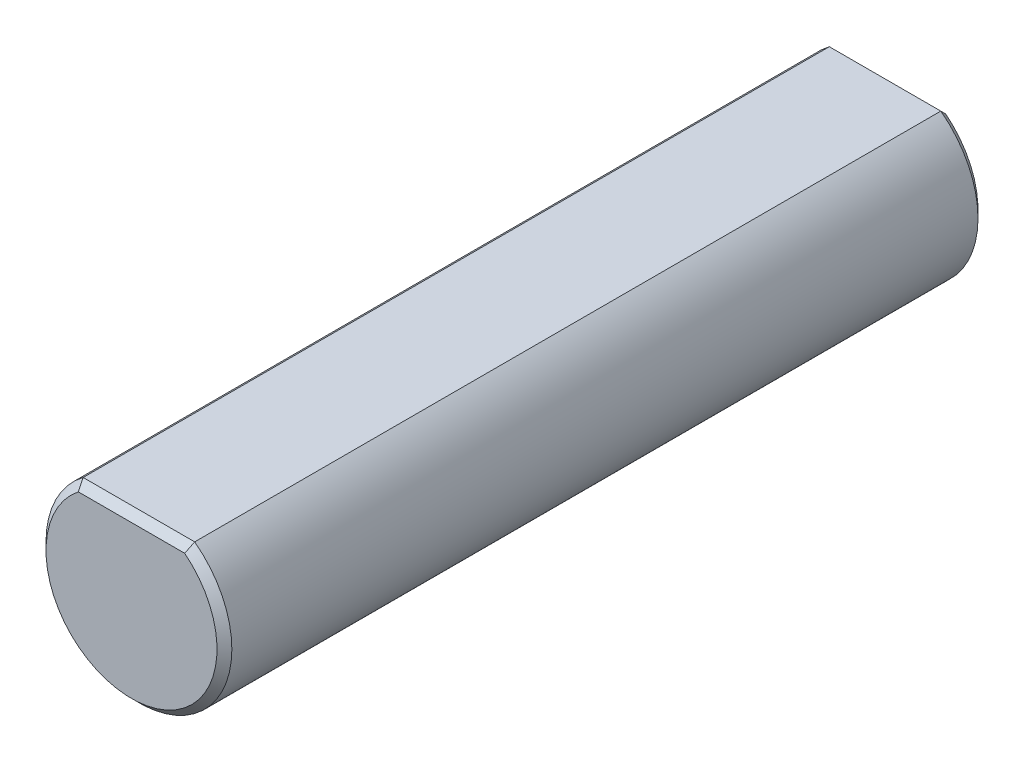
from build123d import *

# Parameters (mm, degrees)
BOSS_EXTRUDE1_DEPTH = 13
CHAMFER1_SIZE       = 0.254


with BuildPart() as part:
    # Sketch1 → Boss-Extrude1 (new, symmetric)
    with BuildSketch(Plane.XY):
        with BuildLine():
            Line((1.905, 2.54), (-1.905, 2.54))
            ThreePointArc((-1.905, 2.54), (0, -3.175), (1.905, 2.54))
        make_face()
    extrude(amount=BOSS_EXTRUDE1_DEPTH, both=True)

    # Chamfer1
    chamfer1_edges = [part.edges().sort_by_distance(p)[0] for p in [
        (0, 2.54, -13),
        (0, -3.175, -13),
        (0, -3.175, 13),
        (0, 2.54, 13),
    ]]
    chamfer(chamfer1_edges, length=CHAMFER1_SIZE)


solid = part.part
